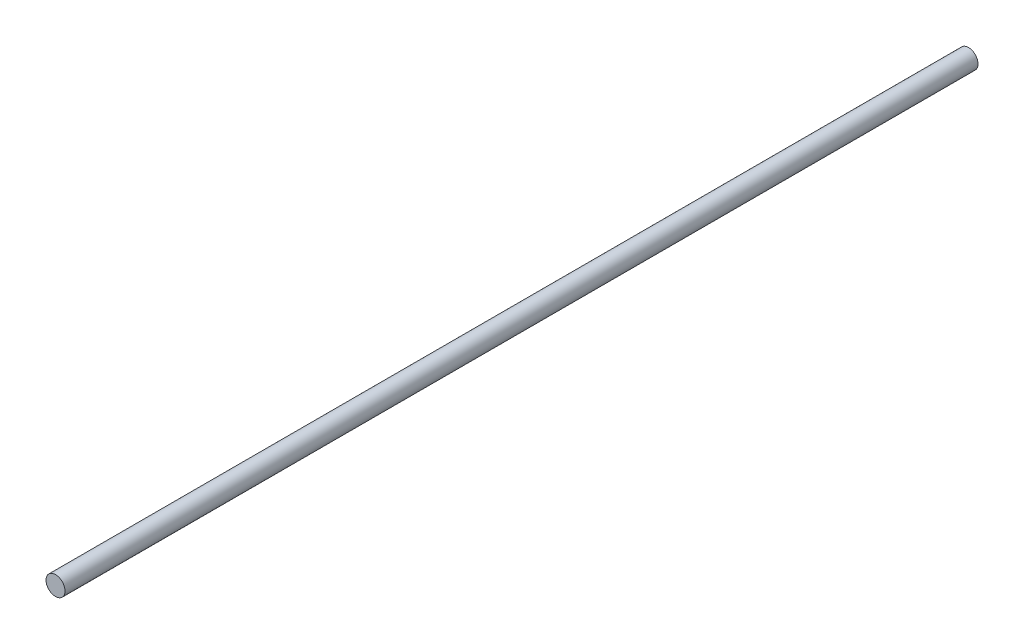
from build123d import *

# Parameters (mm, degrees)
SKETCH3_R           = 3.175
BOSS_EXTRUDE1_DEPTH = 304.8


with BuildPart() as part:
    # Sketch3 → Boss-Extrude1 (new body)
    with BuildSketch(Plane.XY):
        with Locations(Location((0, 0, 0), (0, 0, 180))):
            Circle(SKETCH3_R)
    extrude(amount=BOSS_EXTRUDE1_DEPTH)


solid = part.part
